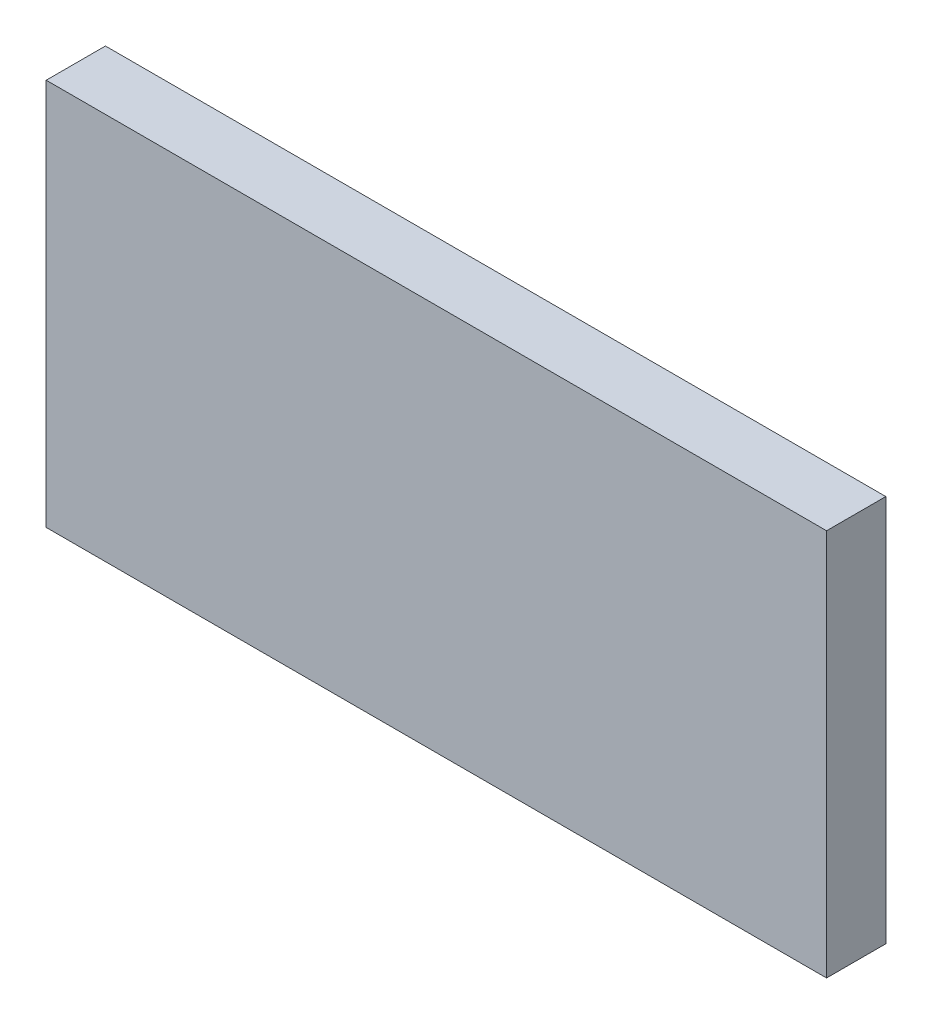
from build123d import *

# Parameters (mm, degrees)
SKETCH_1_W      = 137
SKETCH_1_H      = 68
EXTRUDE_1_DEPTH = 10.4


with BuildPart() as part:
    # 草圖1 → 填料-伸長1 (new body)
    with BuildSketch(Plane.XY):
        with Locations((63.055211199, -31.112207792)):
            Rectangle(SKETCH_1_W, SKETCH_1_H)
    extrude(amount=EXTRUDE_1_DEPTH)


solid = part.part
